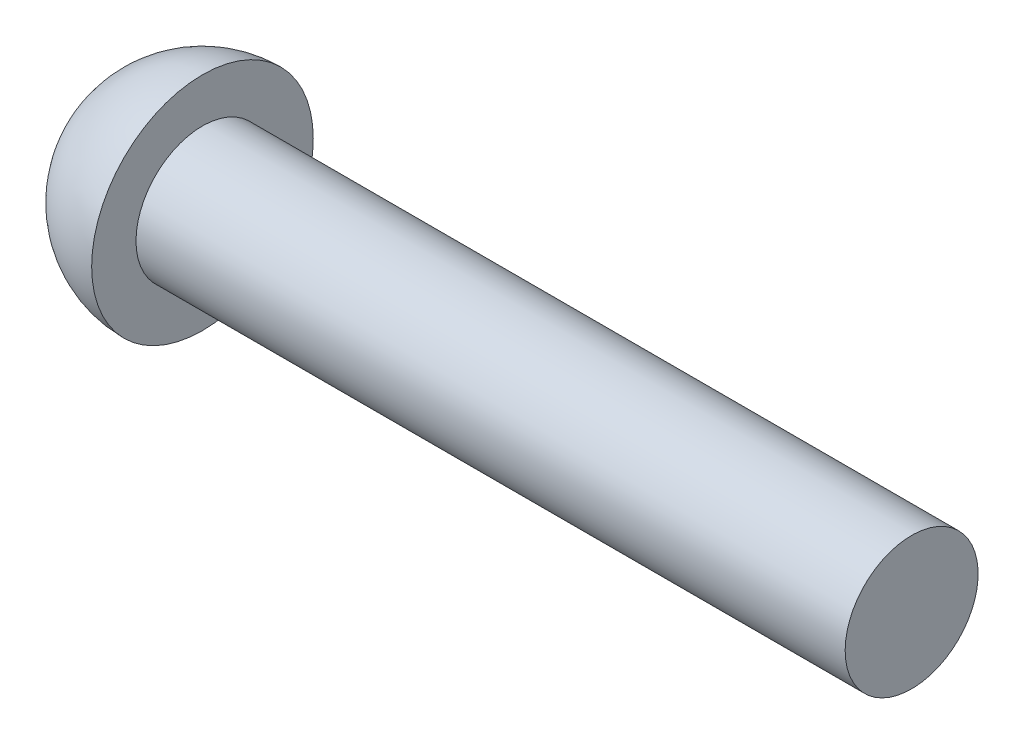
from build123d import *


with BuildPart() as part:
    # Эскиз1 → Повернуть1 (revolve)
    with BuildSketch(Plane.XY):
        with BuildLine():
            Line((16, 0), (-2.5, 0))
            ThreePointArc((-2.5, 0), (-1.767766953, 1.767766953), (0, 2.5))
            Line((0, 2.5), (0, 1.5))
            Line((0, 1.5), (16, 1.5))
            Line((16, 1.5), (16, 0))
        make_face()
    revolve(axis=Axis((-11.901409019, 0, 0), (1, 0, 0)))


solid = part.part
